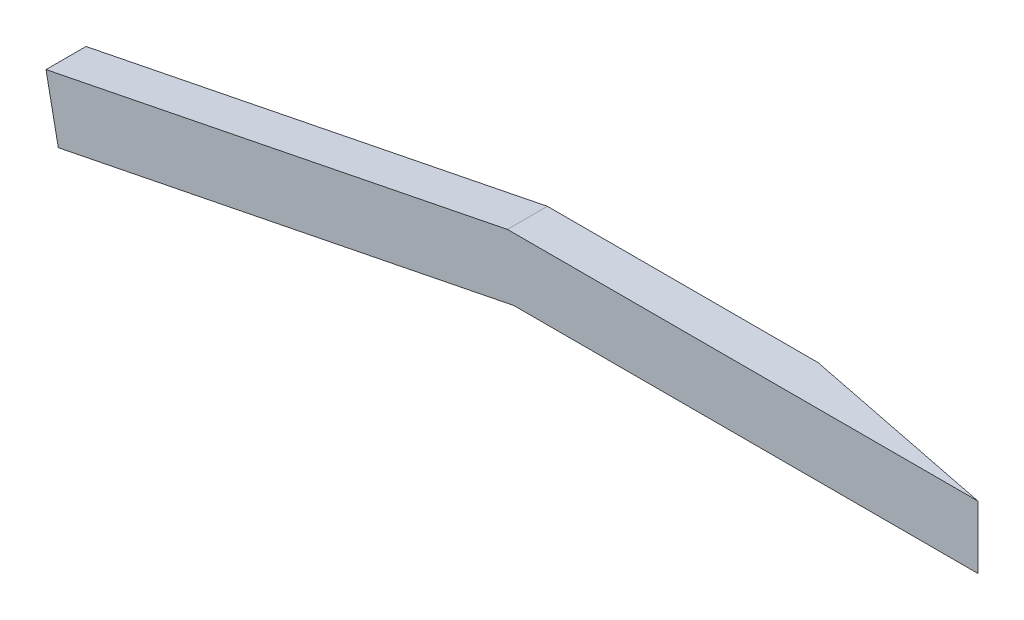
from build123d import *

# Parameters (mm, degrees)
BOSS_EXTRUDE2_DEPTH = 2
BOSS_EXTRUDE4_DEPTH = 1.274755


with BuildPart() as part:
    # Sketch1 → Boss-Extrude2 (new body)
    with BuildSketch(Plane(origin=(0, 0, 0), x_dir=(1, 0, 0), z_dir=(0, 1, 0))):
        Polygon((-1.878719766, -1.397030535), (-1.878719766, -0.122275657), (6.747505842, -0.122275657), (13.121280234, -1.397030535), align=None)
    extrude(amount=BOSS_EXTRUDE2_DEPTH)

    # Sketch4 → Boss-Extrude4 (add)
    with BuildSketch(Plane.XY.offset(1.397030535)):
        Polygon((-1.878719766, 2), (-16.587429902, -0.941742026), (-16.195197632, -2.902903377), (-1.486487496, 0.038838649), align=None)
    extrude(amount=-BOSS_EXTRUDE4_DEPTH)


solid = part.part
